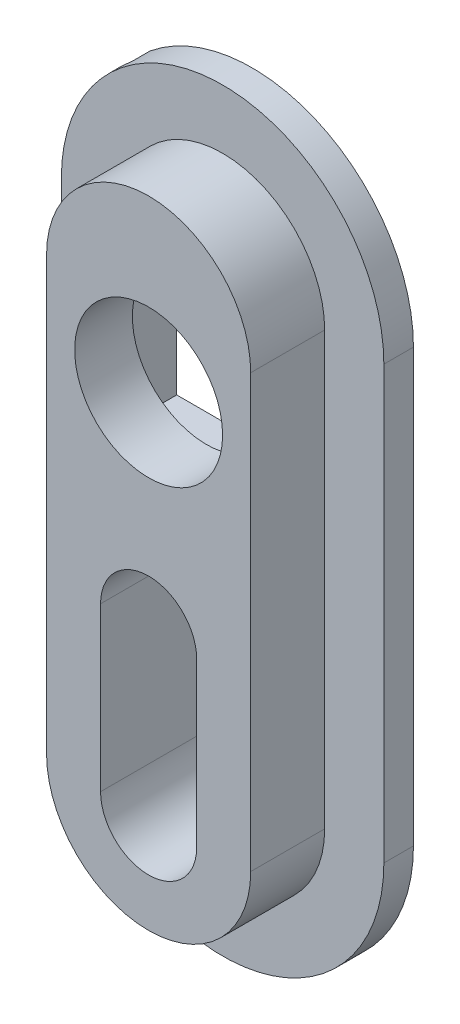
from build123d import *

# Parameters (mm, degrees)
BOSS_EXTRUDE1_DEPTH = 2.5
SKETCH3_R           = 2.5
CUT_EXTRUDE1_DEPTH  = 4
SKETCH4_W           = 5.1
SKETCH4_H           = 6.2
BOSS_EXTRUDE2_DEPTH = 1
SKETCH5_W           = 5.1
SKETCH5_H           = 6.2
CUT_EXTRUDE2_DEPTH  = 0.55
CUT_EXTRUDE3_START  = -0.6
CUT_EXTRUDE3_DEPTH  = 0.6


with BuildPart() as part:
    # Sketch1 → Boss-Extrude1 (new body)
    with BuildSketch(Plane(origin=(0, 0, 0), x_dir=(0, 1, 0), z_dir=(0, 0, 1))):
        with BuildLine():
            Line((-7.3, 3.45), (7.3, 3.45))
            ThreePointArc((7.3, 3.45), (10.75, 0), (7.3, -3.45))
            Line((7.3, -3.45), (-7.3, -3.45))
            ThreePointArc((-7.3, -3.45), (-10.75, 0), (-7.3, 3.45))
        make_face()
    extrude(amount=-BOSS_EXTRUDE1_DEPTH)

    # Sketch3 → Cut-Extrude1 (cut)
    with BuildSketch(Plane.XY):
        with Locations((0, 5)):
            Circle(SKETCH3_R)
        with BuildLine():
            Line((-1.625, -7.5), (-1.625, -2))
            ThreePointArc((-1.625, -2), (0, -0.375), (1.625, -2))
            Line((1.625, -2), (1.625, -7.5))
            ThreePointArc((1.625, -7.5), (0, -9.125), (-1.625, -7.5))
        make_face()
    extrude(amount=-CUT_EXTRUDE1_DEPTH, mode=Mode.SUBTRACT)

    # Sketch4 → Boss-Extrude2 (add)
    with BuildSketch(Plane(origin=(0, 0, -2.5), x_dir=(1, 0, 0), z_dir=(0, 0, -1))):
        with BuildLine():
            Line((-5.45, 7.3), (-5.45, -7.3))
            ThreePointArc((-5.45, -7.3), (0, -12.75), (5.45, -7.3))
            Line((5.45, -7.3), (5.45, 7.3))
            ThreePointArc((5.45, 7.3), (0, 12.75), (-5.45, 7.3))
        make_face()
        with BuildLine():
            Line((1.625, 2), (1.625, 7.5))
            ThreePointArc((1.625, 7.5), (0, 9.125), (-1.625, 7.5))
            Line((-1.625, 7.5), (-1.625, 2))
            ThreePointArc((-1.625, 2), (0, 0.375), (1.625, 2))
        make_face(mode=Mode.SUBTRACT)
        with Locations((0, -5)):
            Rectangle(SKETCH4_W, SKETCH4_H, mode=Mode.SUBTRACT)
    extrude(amount=BOSS_EXTRUDE2_DEPTH)

    # Sketch5 → Cut-Extrude2 (cut)
    with BuildSketch(Plane(origin=(0, 0, -2.5), x_dir=(1, 0, 0), z_dir=(0, 0, -1))):
        with Locations((0, -5)):
            Rectangle(SKETCH5_W, SKETCH5_H)
    extrude(amount=-CUT_EXTRUDE2_DEPTH, mode=Mode.SUBTRACT)

    # Sketch6 → Cut-Extrude3 (cut)
    with BuildSketch(Plane(origin=(0, 0, -3.5), x_dir=(1, 0, 0), z_dir=(0, 0, -1)).offset(CUT_EXTRUDE3_START)):
        with BuildLine():
            Line((-5.45, -7.3), (-5.45, 7.3))
            ThreePointArc((-5.45, 7.3), (-4.924682731, 9.634523506), (-3.45, 11.519004622))
            Line((-3.45, 11.519004622), (-3.45, -11.519004622))
            ThreePointArc((-3.45, -11.519004622), (-4.924682731, -9.634523506), (-5.45, -7.3))
        make_face()
    extrude(amount=CUT_EXTRUDE3_DEPTH, mode=Mode.SUBTRACT)


solid = part.part
